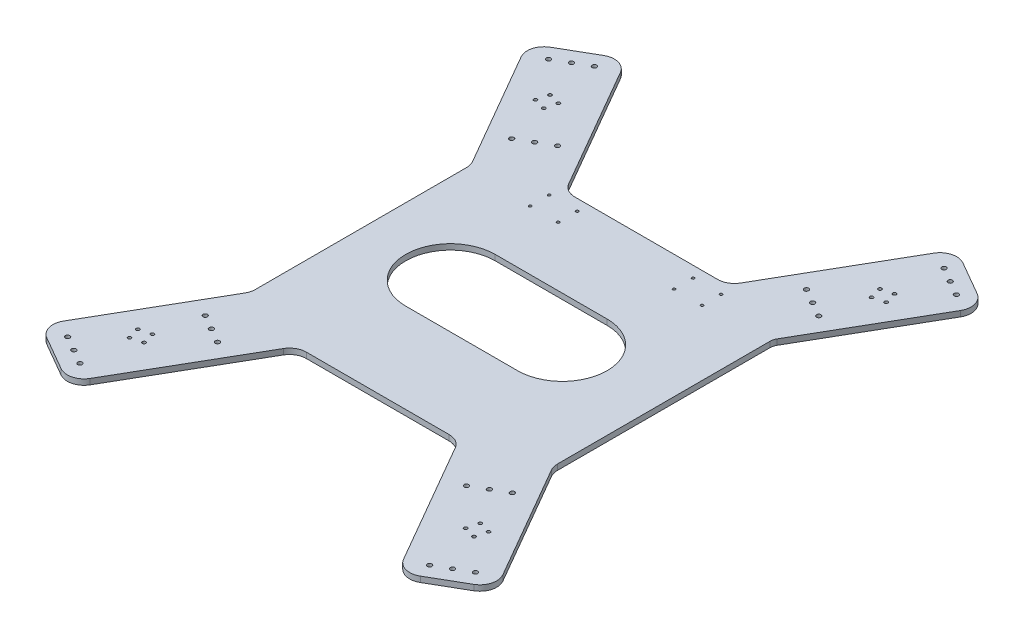
from build123d import *

# Parameters (mm, degrees)
BOSS_EXTRUDE1_DEPTH     = 6.35
FILLET1_R               = 19.05
CUT_EXTRUDE1_DEPTH      = 503.879504709
SKETCH4_R               = 2.54
CUT_EXTRUDE2_DEPTH      = 503.879504709
SKETCH6_R               = 1.905
CUT_EXTRUDE3_DEPTH      = 503.879504709
MIRROR2_COPY_1_SKETCH_R = 2.54
MIRROR2_COPY_1_DEPTH    = 503.879504709
MIRROR2_COPY_2_SKETCH_R = 1.905
MIRROR2_COPY_2_DEPTH    = 503.879504709
FILLET2_R               = 12.7
SKETCH7_R               = 1.524
CUT_EXTRUDE4_DEPTH      = 503.879504709


with BuildPart() as part:
    # Sketch1 → Boss-Extrude1 (new body)
    with BuildSketch(Plane(origin=(0, 0, 0), x_dir=(1, 0, 0), z_dir=(0, 1, 0))):
        Polygon((-171.45, 0), (-258.780132361, 151.260226281), (-187.289735278, 192.535226281), (-92.039735278, 27.55738686), (92.039735278, 27.55738686), (187.289735278, 192.535226281), (258.780132361, 151.260226281), (171.45, 0), (171.45, -249.685226281), (258.780132361, -400.945452561), (187.289735278, -442.220452561), (92.039735278, -277.24261314), (-92.039735278, -277.24261314), (-187.289735278, -442.220452561), (-258.780132361, -400.945452561), (-171.45, -249.685226281), align=None)
    extrude(amount=BOSS_EXTRUDE1_DEPTH)

    # Fillet1
    fillet1_edges = [part.edges().sort_by_distance(p)[0] for p in [
        (-171.45, 3.175, 0),
        (-258.780132361, 3.175, -151.260226281),
        (-187.289735278, 3.175, -192.535226281),
        (-92.039735278, 3.175, -27.55738686),
        (92.039735278, 3.175, -27.55738686),
        (187.289735278, 3.175, -192.535226281),
        (258.780132361, 3.175, -151.260226281),
        (171.45, 3.175, 249.685226281),
        (258.780132361, 3.175, 400.945452561),
        (187.289735278, 3.175, 442.220452561),
        (92.039735278, 3.175, 277.24261314),
        (-92.039735278, 3.175, 277.24261314),
        (-187.289735278, 3.175, 442.220452561),
        (-258.780132361, 3.175, 400.945452561),
        (-171.45, 3.175, 249.685226281),
    ]]
    fillet(fillet1_edges, radius=FILLET1_R)

    # Sketch2 → Cut-Extrude1 (cut, through all)
    with BuildSketch(Plane(origin=(0, 6.35, 0), x_dir=(1, 0, 0), z_dir=(0, 1, 0))):
        with BuildLine():
            Line((-69.85, -74.04261314), (57.15, -74.04261314))
            ThreePointArc((57.15, -74.04261314), (107.95, -124.84261314), (57.15, -175.64261314))
            Line((57.15, -175.64261314), (-69.85, -175.64261314))
            ThreePointArc((-69.85, -175.64261314), (-120.65, -124.84261314), (-69.85, -74.04261314))
        make_face()
    cut_extrude1 = extrude(amount=-CUT_EXTRUDE1_DEPTH, mode=Mode.SUBTRACT)

    # Sketch4 → Cut-Extrude2 (cut, through all)
    with BuildSketch(Plane.XZ):
        with Locations(Location((198.392135104, -167.061146864, 0), (0, 0, 270))):
            Circle(SKETCH4_R)
        with Locations(Location((214.889919046, -157.536146864, 0), (0, 0, 270))):
            Circle(SKETCH4_R)
        with Locations(Location((231.387702988, -148.011146864, 0), (0, 0, 270))):
            Circle(SKETCH4_R)
        with Locations(Location((141.242135104, -68.074443212, 0), (0, 0, 90))):
            Circle(SKETCH4_R)
        with Locations(Location((174.237702988, -49.024443212, 0), (0, 0, 90))):
            Circle(SKETCH4_R)
        with Locations(Location((157.739919046, -58.549443212, 0), (0, 0, 90))):
            Circle(SKETCH4_R)
    cut_extrude2 = extrude(amount=-CUT_EXTRUDE2_DEPTH, mode=Mode.SUBTRACT)

    # Sketch6 → Cut-Extrude3 (cut, through all)
    with BuildSketch(Plane(origin=(0, 6.35, 0), x_dir=(1, 0, 0), z_dir=(0, 1, 0))):
        with Locations(Location((198.963220068, 100.740295038, 0), (0, 0, 270))):
            Circle(SKETCH6_R)
        with Locations(Location((185.951828097, 97.253903067, 0), (0, 0, 270))):
            Circle(SKETCH6_R)
        with Locations(Location((182.465436126, 110.265295038, 0), (0, 0, 270))):
            Circle(SKETCH6_R)
        with Locations(Location((195.476828097, 113.751687009, 0), (0, 0, 270))):
            Circle(SKETCH6_R)
    cut_extrude3 = extrude(amount=-CUT_EXTRUDE3_DEPTH, mode=Mode.SUBTRACT)

    # Mirror1: Cut-Extrude2, Cut-Extrude3 across plane
    add(cut_extrude2.mirror(Plane(origin=(0, 0, 0), x_dir=(0, 0, 1), z_dir=(1, 0, 0))), mode=Mode.SUBTRACT)
    add(cut_extrude3.mirror(Plane(origin=(0, 0, 0), x_dir=(0, 0, 1), z_dir=(1, 0, 0))), mode=Mode.SUBTRACT)

    # Mirror2: Cut-Extrude1, Cut-Extrude2, Cut-Extrude3 across plane
    add(cut_extrude1.mirror(Plane(origin=(0, 0, 124.84261314), x_dir=(1, 0, 0), z_dir=(0, 0, -1))), mode=Mode.SUBTRACT)
    add(cut_extrude2.mirror(Plane(origin=(0, 0, 124.84261314), x_dir=(1, 0, 0), z_dir=(0, 0, -1))), mode=Mode.SUBTRACT)
    add(cut_extrude3.mirror(Plane(origin=(0, 0, 124.84261314), x_dir=(1, 0, 0), z_dir=(0, 0, -1))), mode=Mode.SUBTRACT)

    # Mirror2 copy 1 sketch → Mirror2 copy 1 (cut, through all)
    with BuildSketch(Plane(origin=(0, 0, 249.685226281), x_dir=(-1, 0, 0), z_dir=(0, -1, 0))):
        with Locations(Location((198.392135104, -167.061146864, 0), (0, 0, 270))):
            Circle(MIRROR2_COPY_1_SKETCH_R)
        with Locations(Location((214.889919046, -157.536146864, 0), (0, 0, 270))):
            Circle(MIRROR2_COPY_1_SKETCH_R)
        with Locations(Location((231.387702988, -148.011146864, 0), (0, 0, 270))):
            Circle(MIRROR2_COPY_1_SKETCH_R)
        with Locations(Location((141.242135104, -68.074443212, 0), (0, 0, 90))):
            Circle(MIRROR2_COPY_1_SKETCH_R)
        with Locations(Location((174.237702988, -49.024443212, 0), (0, 0, 90))):
            Circle(MIRROR2_COPY_1_SKETCH_R)
        with Locations(Location((157.739919046, -58.549443212, 0), (0, 0, 90))):
            Circle(MIRROR2_COPY_1_SKETCH_R)
    extrude(amount=-MIRROR2_COPY_1_DEPTH, mode=Mode.SUBTRACT)

    # Mirror2 copy 2 sketch → Mirror2 copy 2 (cut, through all)
    with BuildSketch(Plane(origin=(0, 6.35, 249.685226281), x_dir=(-1, 0, 0), z_dir=(0, 1, 0))):
        with Locations(Location((198.963220068, 100.740295038, 0), (0, 0, 270))):
            Circle(MIRROR2_COPY_2_SKETCH_R)
        with Locations(Location((185.951828097, 97.253903067, 0), (0, 0, 270))):
            Circle(MIRROR2_COPY_2_SKETCH_R)
        with Locations(Location((182.465436126, 110.265295038, 0), (0, 0, 270))):
            Circle(MIRROR2_COPY_2_SKETCH_R)
        with Locations(Location((195.476828097, 113.751687009, 0), (0, 0, 270))):
            Circle(MIRROR2_COPY_2_SKETCH_R)
    extrude(amount=-MIRROR2_COPY_2_DEPTH, mode=Mode.SUBTRACT)

    # Fillet2
    fillet2_edges = [part.edges().sort_by_distance(p)[0] for p in [
        (171.45, 3.175, 0),
    ]]
    fillet(fillet2_edges, radius=FILLET2_R)

    # Sketch7 → Cut-Extrude4 (cut, through all)
    with BuildSketch(Plane(origin=(0, 6.35, 0), x_dir=(1, 0, 0), z_dir=(0, 1, 0))):
        with Locations(Location((-97.538996592, 14.85738686, 0), (0, 0, 270))):
            Circle(SKETCH7_R)
        with Locations(Location((-97.538996592, -6.73261314, 0), (0, 0, 270))):
            Circle(SKETCH7_R)
        with Locations(Location((-65.788996592, 14.85738686, 0), (0, 0, 270))):
            Circle(SKETCH7_R)
        with Locations(Location((-65.788996592, -6.73261314, 0), (0, 0, 270))):
            Circle(SKETCH7_R)
        with Locations(Location((97.538996592, -6.73261314, 0), (0, 0, 90))):
            Circle(SKETCH7_R)
        with Locations(Location((97.538996592, 14.85738686, 0), (0, 0, 90))):
            Circle(SKETCH7_R)
        with Locations(Location((65.788996592, 14.85738686, 0), (0, 0, 90))):
            Circle(SKETCH7_R)
        with Locations(Location((65.788996592, -6.73261314, 0), (0, 0, 90))):
            Circle(SKETCH7_R)
    extrude(amount=-CUT_EXTRUDE4_DEPTH, mode=Mode.SUBTRACT)


solid = part.part
